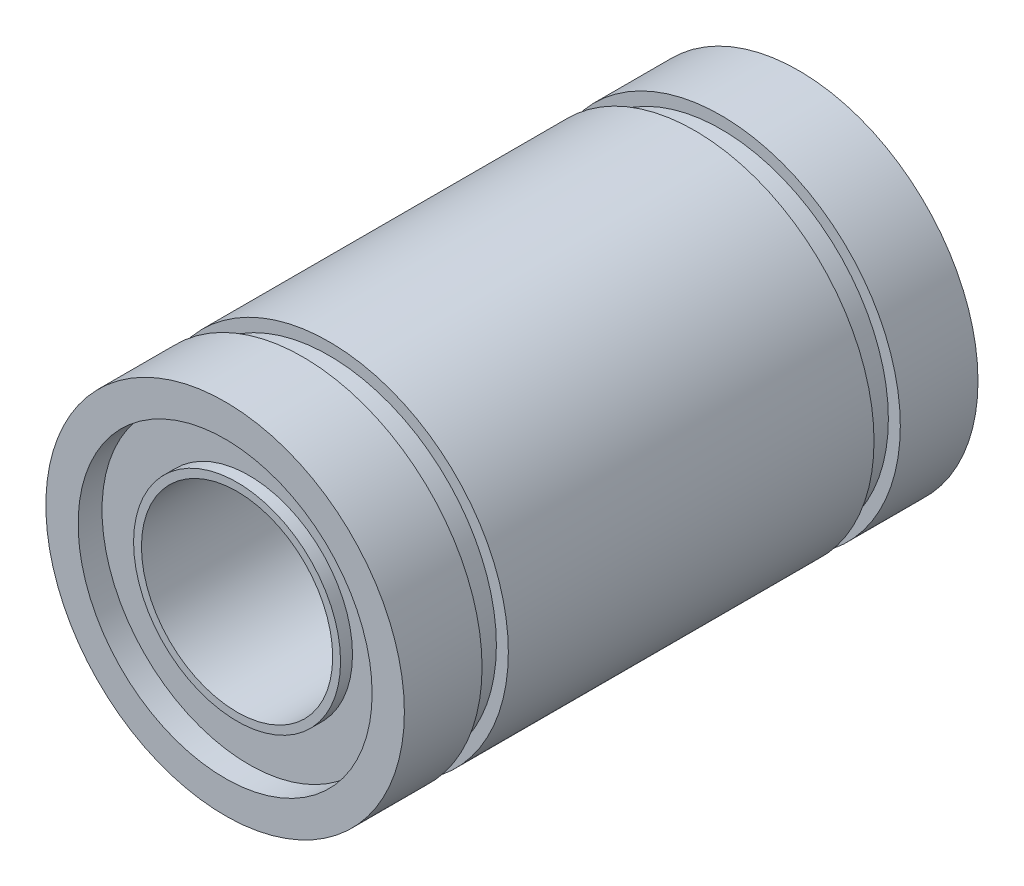
from build123d import *


with BuildPart() as part:
    # Sketch1 → Revolve1 (revolve)
    with BuildSketch(Plane(origin=(0, 0, 0), x_dir=(1, 0, 0), z_dir=(0, 1, 0))):
        Polygon((4.33, -0.5), (4, -0.5), (4, -23.5), (4.33, -23.5), (4.33, -23), (6.15, -23), (6.15, -24), (7.5, -24), (7.5, -20.75), (7, -20.75), (7, -19.65), (7.5, -19.65), (7.5, -4.35), (7, -4.35), (7, -3.25), (7.5, -3.25), (7.5, 0), (6.15, 0), (6.15, -1), (4.33, -1), align=None)
    revolve(axis=Axis((0, 0, 0), (0, 0, 1)))


solid = part.part
